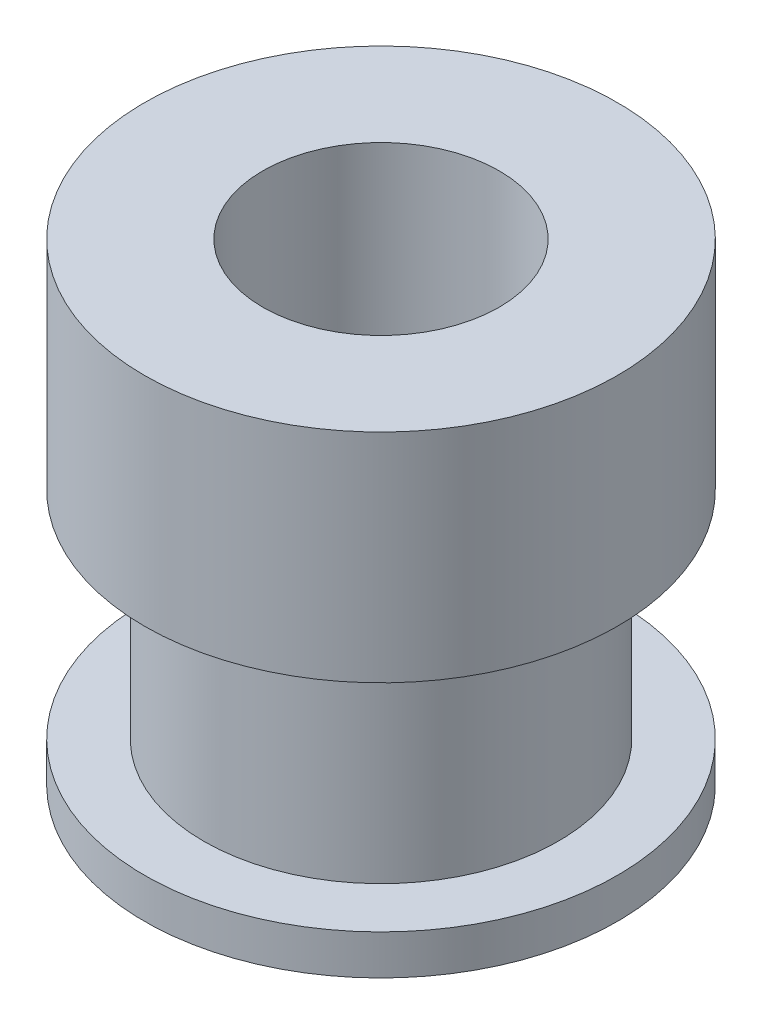
from build123d import *

# Parameters (mm, degrees)
SKETCH_1_R          = 8
EXTRUDE_1_DEPTH     = 1.35
SKETCH_4_R          = 6
EXTRUDE_3_DEPTH     = 7.3
EXTRUDE_START       = 8.65
SKETCH_1_3_R        = 8
EXTRUDE_4_DEPTH     = 7.35
SKETCH_5_R          = 4
CUT_EXTRUDE_1_DEPTH = 20.595917942


with BuildPart() as part:
    # 草图1 → 凸台-拉伸1 (new body)
    with BuildSketch(Plane(origin=(0, 0, 0), x_dir=(1, 0, 0), z_dir=(0, 1, 0))):
        with Locations(Location((0, 0, 0), (0, 0, 90))):
            Circle(SKETCH_1_R)
    extrude(amount=EXTRUDE_1_DEPTH)

    # 草图4 → 凸台-拉伸3 (add)
    with BuildSketch(Plane(origin=(0, 1.35, 0), x_dir=(1, 0, 0), z_dir=(0, 1, 0))):
        with Locations(Location((0, 0, 0), (0, 0, 270))):
            Circle(SKETCH_4_R)
    extrude(amount=EXTRUDE_3_DEPTH)

    # 草图1<3> → 凸台-拉伸4 (add)
    with BuildSketch(Plane(origin=(0, 0, 0), x_dir=(1, 0, 0), z_dir=(0, 1, 0)).offset(EXTRUDE_START)):
        with Locations(Location((0, 0, 0), (0, 0, 90))):
            Circle(SKETCH_1_3_R)
    extrude(amount=EXTRUDE_4_DEPTH)

    # 草图5 → 切除-拉伸1 (cut, through all)
    with BuildSketch(Plane.XZ):
        with Locations(Location((0, 0, 0), (0, 0, 270))):
            Circle(SKETCH_5_R)
    extrude(amount=-CUT_EXTRUDE_1_DEPTH, mode=Mode.SUBTRACT)


solid = part.part
